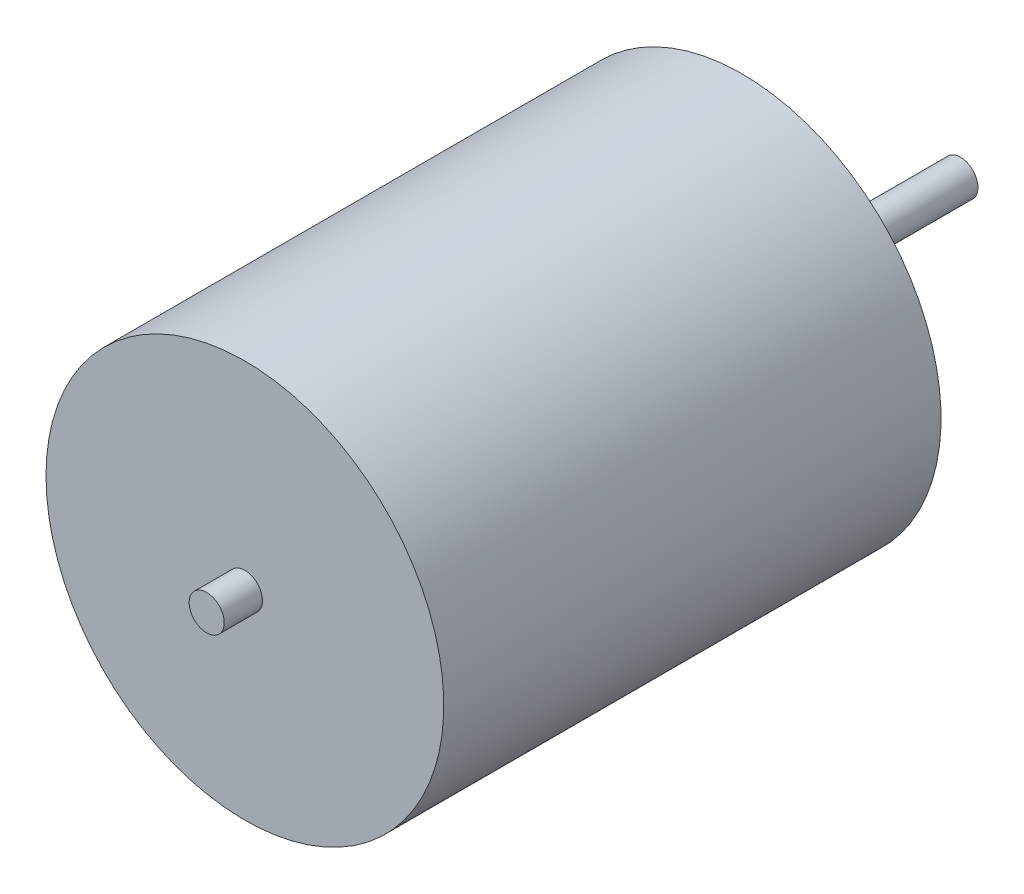
from build123d import *

# Parameters (mm, degrees)
SKETCH3_W          = 1.5875
SKETCH3_H          = 68.218126879
SKETCH4_W          = 16.5
SKETCH4_H          = 42
CUT_EXTRUDE1_REACH = 56.738
SKETCH5_R          = 1.5


with BuildPart() as part:
    # Sketch2 → Revolve1 (revolve)
    with BuildSketch(Plane(origin=(0, 0, 0), x_dir=(1, 0, 0), z_dir=(0, 1, 0)), mode=Mode.PRIVATE) as revolve1_sk:
        Polygon((0, 0), (18, 0), (18, 45), (6.5, 45), (6.5, 50), (5.455078682, 50), (5.455078682, 49.6), (0, 49.6), align=None)
    revolve(revolve1_sk.sketch.rotate(Axis((0, 0, -54.973870739), (0, 0, 1)), 180), axis=Axis((0, 0, -54.973870739), (0, 0, 1)))

    # Sketch3 → Revolve-Thin1 (revolve)
    with BuildSketch(Plane(origin=(0, 0, 0), x_dir=(1, 0, 0), z_dir=(0, 1, 0)), mode=Mode.PRIVATE) as revolve_thin1_sk:
        with Locations((-0.79375, 30.65040302)):
            Rectangle(SKETCH3_W, SKETCH3_H)
    revolve(revolve_thin1_sk.sketch.rotate(Axis((0, 0, 0), (0, 0, -1)), 180), axis=Axis((0, 0, 0), (0, 0, -1)))

    # Sketch4 → Cut-Revolve2 (revolve, cut)
    with BuildSketch(Plane(origin=(0, 0, 0), x_dir=(1, 0, 0), z_dir=(0, 1, 0))):
        with Locations((8.25, 22.5)):
            Rectangle(SKETCH4_W, SKETCH4_H)
    revolve(axis=Axis((0, 0, 0), (0, 0, -1)), mode=Mode.SUBTRACT)

    # Sketch5 → Cut-Extrude1 (cut, up to next)
    with BuildSketch(Plane(origin=(0, 0, -45), x_dir=(-1, 0, 0), z_dir=(0, 0, -1)), mode=Mode.PRIVATE) as cut_extrude1_sk1:
        with Locations((9.545941546, 9.545941546)):
            Circle(SKETCH5_R)
    cut_extrude1_tool1 = extrude(cut_extrude1_sk1.sketch, amount=-CUT_EXTRUDE1_REACH, mode=Mode.PRIVATE) & part.part
    # Sketch5 → Cut-Extrude1 (cut, up to next)
    with BuildSketch(Plane(origin=(0, 0, -45), x_dir=(-1, 0, 0), z_dir=(0, 0, -1)), mode=Mode.PRIVATE) as cut_extrude1_sk2:
        with Locations((-9.545941546, -9.545941546)):
            Circle(SKETCH5_R)
    cut_extrude1_tool2 = extrude(cut_extrude1_sk2.sketch, amount=-CUT_EXTRUDE1_REACH, mode=Mode.PRIVATE) & part.part
    # Sketch5 → Cut-Extrude1 (cut, up to next)
    with BuildSketch(Plane(origin=(0, 0, -45), x_dir=(-1, 0, 0), z_dir=(0, 0, -1)), mode=Mode.PRIVATE) as cut_extrude1_sk3:
        with BuildLine():
            ThreePointArc((0, 14), (-9.899494937, 9.899494937), (-14, 0))
            ThreePointArc((-14, 0), (-12.5, -1.5), (-11, 0))
            ThreePointArc((-11, 0), (-7.778174593, 7.778174593), (0, 11))
            ThreePointArc((0, 11), (1.5, 12.5), (0, 14))
        make_face()
    cut_extrude1_tool3 = extrude(cut_extrude1_sk3.sketch, amount=-CUT_EXTRUDE1_REACH, mode=Mode.PRIVATE) & part.part
    # Sketch5 → Cut-Extrude1 (cut, up to next)
    with BuildSketch(Plane(origin=(0, 0, -45), x_dir=(-1, 0, 0), z_dir=(0, 0, -1)), mode=Mode.PRIVATE) as cut_extrude1_sk4:
        with BuildLine():
            ThreePointArc((14, 0), (9.899494937, -9.899494937), (0, -14))
            ThreePointArc((0, -14), (-1.5, -12.5), (0, -11))
            ThreePointArc((0, -11), (7.778174593, -7.778174593), (11, 0))
            ThreePointArc((11, 0), (12.5, 1.5), (14, 0))
        make_face()
    cut_extrude1_tool4 = extrude(cut_extrude1_sk4.sketch, amount=-CUT_EXTRUDE1_REACH, mode=Mode.PRIVATE) & part.part
    add(cut_extrude1_tool1.solids().sort_by_distance((-9.545942, 9.545942, -45))[0], mode=Mode.SUBTRACT)
    add(cut_extrude1_tool2.solids().sort_by_distance((9.545942, -9.545942, -45))[0], mode=Mode.SUBTRACT)
    add(cut_extrude1_tool3.solids().sort_by_distance((12.5, -1.280797, -45))[0], mode=Mode.SUBTRACT)
    add(cut_extrude1_tool4.solids().sort_by_distance((-7.933175, -7.933175, -45))[0], mode=Mode.SUBTRACT)


solid = part.part
